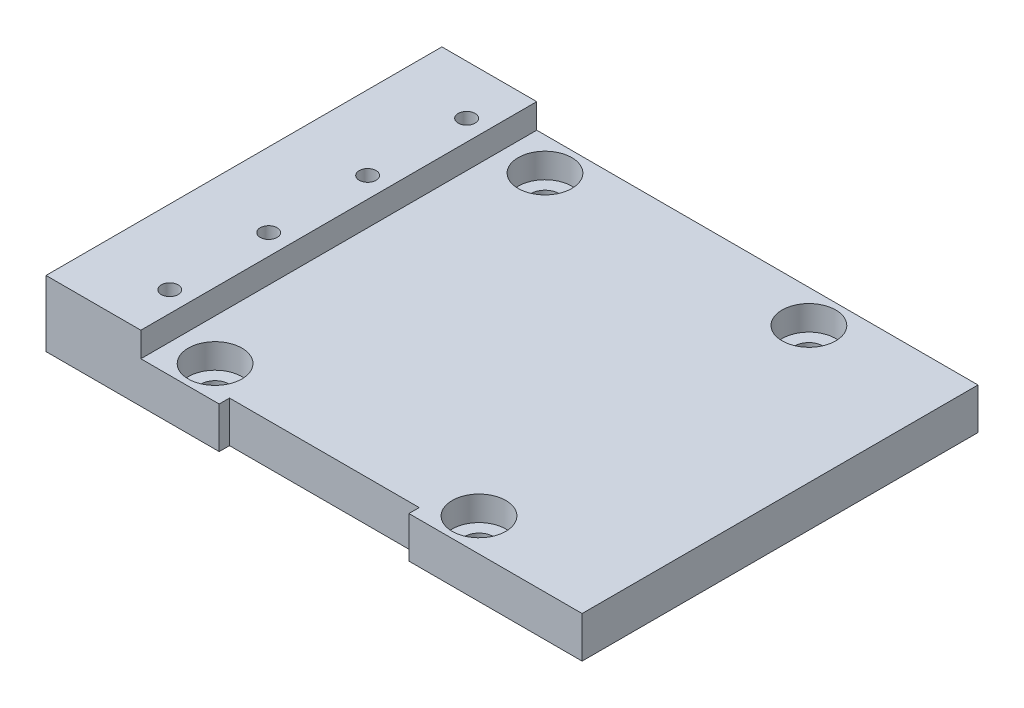
from build123d import *

# Parameters (mm, degrees)
SKETCH1_W                      = 65
SKETCH1_H                      = 48
BOSS_EXTRUDE1_DEPTH            = 5
SKETCH2_W                      = 11.5
SKETCH2_H                      = 48
BOSS_EXTRUDE2_DEPTH            = 3
M2_5X0_45_TAPPED_HOLE1_D       = 2.05
M2_5X0_45_TAPPED_HOLE1_DEPTH   = 6.35
CBORE_FOR_M3_SHCS1_D           = 3.4
CBORE_FOR_M3_SHCS1_CBORE_D     = 6.5
CBORE_FOR_M3_SHCS1_CBORE_DEPTH = 3
SKETCH7_W                      = 23
SKETCH7_H                      = 5
CUT_EXTRUDE1_DEPTH             = 1.25


with BuildPart() as part:
    # Sketch1 → Boss-Extrude1 (new body)
    with BuildSketch(Plane(origin=(0, 0, 0), x_dir=(1, 0, 0), z_dir=(0, 1, 0))):
        Rectangle(SKETCH1_W, SKETCH1_H)
    extrude(amount=BOSS_EXTRUDE1_DEPTH)

    # Sketch2 → Boss-Extrude2 (add)
    with BuildSketch(Plane(origin=(0, 5, 0), x_dir=(1, 0, 0), z_dir=(0, 1, 0))):
        with Locations((-26.75, 0)):
            Rectangle(SKETCH2_W, SKETCH2_H)
    extrude(amount=BOSS_EXTRUDE2_DEPTH)

    # M2.5x0.45 Tapped Hole1
    with Locations(Plane(origin=(0, 8, 0), x_dir=(1, 0, 0), z_dir=(0, 1, 0))):
        with Locations((-23.5, 18), (-23.5, 6), (-23.5, -18), (-23.5, -6)):
            Hole(M2_5X0_45_TAPPED_HOLE1_D / 2, depth=M2_5X0_45_TAPPED_HOLE1_DEPTH)

    # CBORE for M3 SHCS1 (through all)
    with Locations(Plane(origin=(0, 5, 0), x_dir=(1, 0, 0), z_dir=(0, 1, 0))):
        with Locations((-16, 20), (16, 20), (-16, -20), (16, -20)):
            CounterBoreHole(CBORE_FOR_M3_SHCS1_D / 2, CBORE_FOR_M3_SHCS1_CBORE_D / 2, CBORE_FOR_M3_SHCS1_CBORE_DEPTH)

    # Sketch7 → Cut-Extrude1 (cut)
    with BuildSketch(Plane.XY.offset(24)):
        with Locations((0, 2.5)):
            Rectangle(SKETCH7_W, SKETCH7_H)
    extrude(amount=-CUT_EXTRUDE1_DEPTH, mode=Mode.SUBTRACT)


solid = part.part
